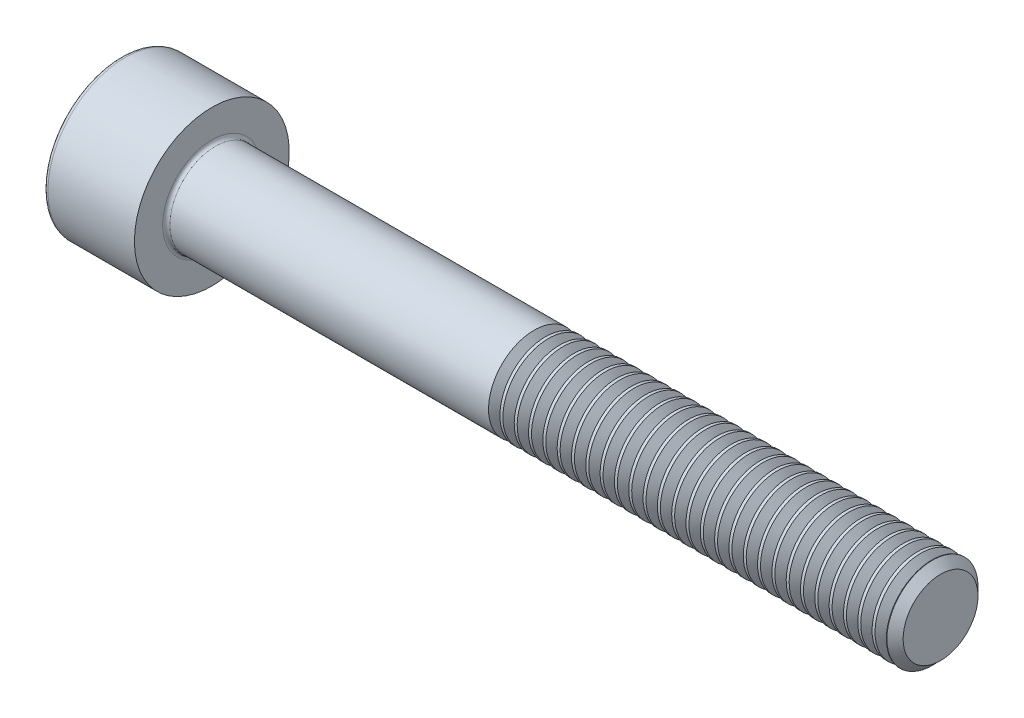
from build123d import *

# Parameters (mm, degrees)
FILLET1_R       = 0.2
FILLET2_R       = 0.25
HEX_2_DEPTH     = 2.5
THDSCHPAT_COUNT = 28
THDSCHPAT_PITCH = 0.785714286


with BuildPart() as part:
    # BodySke → Base-Revolve (revolve)
    with BuildSketch(Plane.XY, mode=Mode.PRIVATE) as base_revolve_sk:
        Polygon((0, 0), (0, 4.25), (5, 4.25), (5, 2.5), (44.555, 2.5), (45, 2.055), (45, 0), align=None)
    revolve(base_revolve_sk.sketch.rotate(Axis((-31.75, 0, 0), (1, 0, 0)), 90), axis=Axis((-31.75, 0, 0), (1, 0, 0)))

    # Fillet1
    fillet1_edges = [part.edges().sort_by_distance(p)[0] for p in [
        (5, 0, -2.5),
    ]]
    fillet(fillet1_edges, radius=FILLET1_R)

    # Fillet2
    fillet2_edges = [part.edges().sort_by_distance(p)[0] for p in [
        (0, 0, -4.25),
    ]]
    fillet(fillet2_edges, radius=FILLET2_R)

    # Sketch2 → Hex-PreBroach (revolve, cut)
    with BuildSketch(Plane.XY, mode=Mode.PRIVATE) as hex_prebroach_sk:
        Polygon((0, 2.042), (2.5, 2.042), (3.67894925, 0), (0, 0), align=None)
    revolve(hex_prebroach_sk.sketch.rotate(Axis((0, 0, 0), (1, 0, 0)), 90), axis=Axis((0, 0, 0), (1, 0, 0)), mode=Mode.SUBTRACT)

    # Sketch3 → Hex 2 (cut)
    with BuildSketch(Plane(origin=(0, 0, 0), x_dir=(0, 0.500000000000001, 0.866025403784438), z_dir=(-1, 0, 0))):
        Polygon((1.17894925, 2.042), (-1.17894925, 2.042), (-2.357898499, 0), (-1.17894925, -2.042), (1.17894925, -2.042), (2.357898499, 0), align=None)
    extrude(amount=-HEX_2_DEPTH, mode=Mode.SUBTRACT)

    # ThdSchSke → ThreadSchematic (revolve, cut)
    with BuildSketch(Plane.XY):
        Polygon((23, -2.055), (22.688407645, -2.5), (22.688407645, -3.125), (23.311592355, -3.125), (23.311592355, -2.5), align=None)
    threadschematic = revolve(axis=Axis((-3.175, 0, 0), (1, 0, 0)), mode=Mode.SUBTRACT)

    # ThdSchPat: ThreadSchematic ×28
    with Locations(*[(i * THDSCHPAT_PITCH, 0, 0) for i in range(1, THDSCHPAT_COUNT)]):
        add(threadschematic, mode=Mode.SUBTRACT)


solid = part.part
